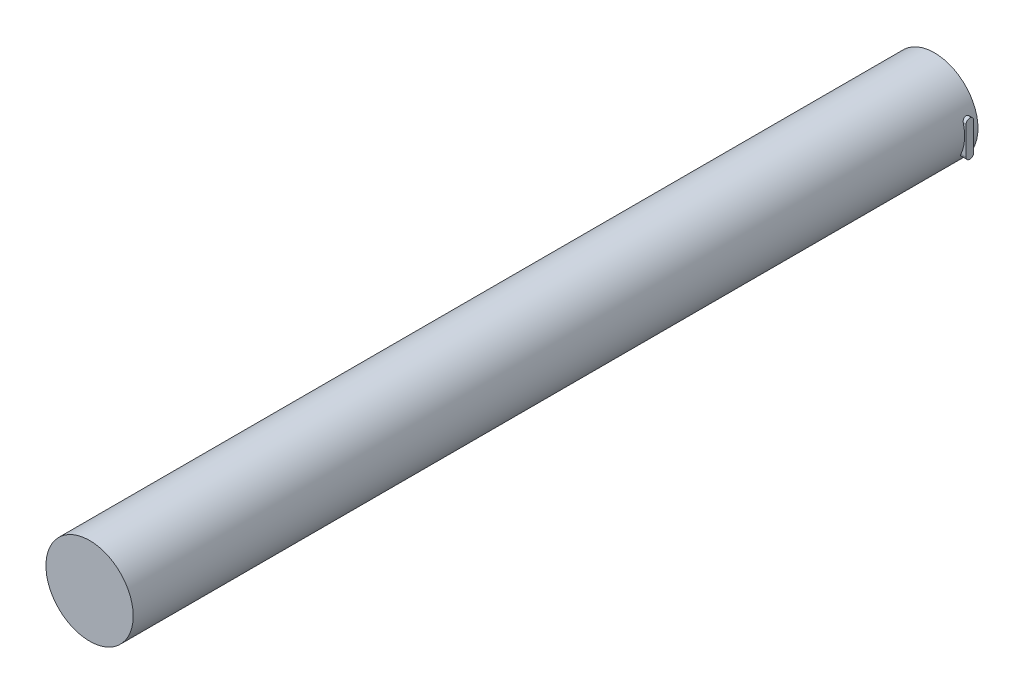
from build123d import *

# Parameters (mm, degrees)
SKETCH1_R           = 9.8425
BOSS_EXTRUDE1_DEPTH = 190.5
BOSS_EXTRUDE6_DEPTH = 10.16


with BuildPart() as part:
    # Sketch1 → Boss-Extrude1 (new body)
    with BuildSketch(Plane.XY):
        Circle(SKETCH1_R)
    extrude(amount=BOSS_EXTRUDE1_DEPTH)

    # Sketch6 → Boss-Extrude6 (add)
    with BuildSketch(Plane(origin=(0, 0, 0), x_dir=(0, 0, -1), z_dir=(1, 0, 0))):
        with BuildLine():
            Line((-1.301661294, 2.396009349), (-1.301661294, -3.953990651))
            ThreePointArc((-1.301661294, -3.953990651), (-2.161224479, -4.813553836), (-3.020787664, -3.953990651))
            Line((-3.020787664, -3.953990651), (-3.020787664, 2.396009349))
            ThreePointArc((-3.020787664, 2.396009349), (-2.161224479, 3.255572534), (-1.301661294, 2.396009349))
        make_face()
    extrude(amount=BOSS_EXTRUDE6_DEPTH)


solid = part.part
